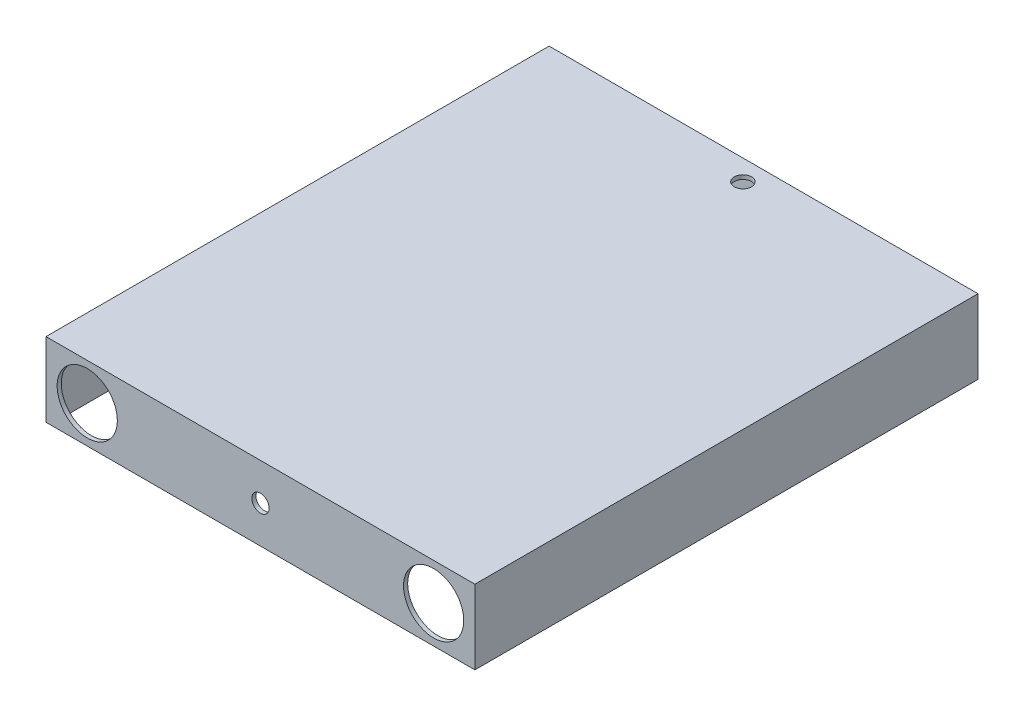
from build123d import *

# Parameters (mm, degrees)
SKETCH1_W           = 520
SKETCH1_H           = 610
BOSS_EXTRUDE1_DEPTH = 45
SHELL1_T            = -5
SKETCH4_R           = 10.5
CUT_EXTRUDE2_DEPTH  = 10
SKETCH5_R           = 10.5
CUT_EXTRUDE3_DEPTH  = 10
SKETCH3_R           = 36.5
CUT_EXTRUDE4_DEPTH  = 25


with BuildPart() as part:
    # Sketch1 → Boss-Extrude1 (new, symmetric)
    with BuildSketch(Plane(origin=(0, 0, 0), x_dir=(1, 0, 0), z_dir=(0, 1, 0))):
        Rectangle(SKETCH1_W, SKETCH1_H)
    extrude(amount=BOSS_EXTRUDE1_DEPTH, both=True)

    # Shell1
    shell1_openings = [part.faces().sort_by_distance(p)[0] for p in [
        (0, -45, 0),
    ]]
    offset(amount=SHELL1_T, openings=shell1_openings, kind=Kind.INTERSECTION)

    # Sketch4 → Cut-Extrude2 (cut)
    with BuildSketch(Plane(origin=(0, 45, 0), x_dir=(1, 0, 0), z_dir=(0, 1, 0))):
        with Locations((0, 280)):
            Circle(SKETCH4_R)
    extrude(amount=-CUT_EXTRUDE2_DEPTH, mode=Mode.SUBTRACT)

    # Sketch5 → Cut-Extrude3 (cut)
    with BuildSketch(Plane.XY.offset(305)):
        Circle(SKETCH5_R)
    extrude(amount=-CUT_EXTRUDE3_DEPTH, mode=Mode.SUBTRACT)

    # Sketch3 → Cut-Extrude4 (cut)
    with BuildSketch(Plane.XY.offset(305)):
        with Locations((-210, 0)):
            Circle(SKETCH3_R)
        with Locations((210, 0)):
            Circle(SKETCH3_R)
    extrude(amount=-CUT_EXTRUDE4_DEPTH, mode=Mode.SUBTRACT)


solid = part.part
